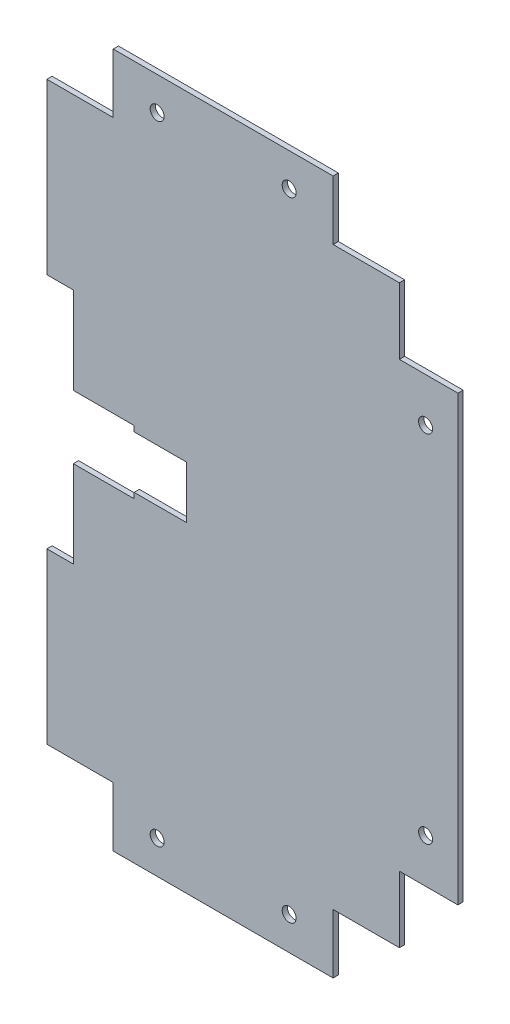
from build123d import *

# Parameters (mm, degrees)
SKETCH1_R           = 4
BOSS_EXTRUDE2_DEPTH = 3


with BuildPart() as part:
    # Sketch1 → Boss-Extrude2 (new body)
    with BuildSketch(Plane.XY):
        Polygon((160.82, 34.005), (195.645, 34.005), (198.82, 34.005), (198.82, 37.18), (198.82, 72.005), (232.325, 72.005), (232.325, 325.985), (198.82, 325.985), (198.82, 360.81), (198.82, 363.985), (195.645, 363.985), (160.82, 363.985), (160.82, 397.99), (34.825, 397.99), (34.825, 363.985), (0, 363.985), (-3.175, 363.985), (-3.175, 266.995), (12.005, 266.995), (12.005, 252), (12.005, 217.17), (46.835, 217.17), (46.835, 213.995), (76.83, 213.995), (76.83, 183.995), (46.835, 183.995), (46.835, 180.82), (12.005, 180.82), (12.005, 145.99), (12.005, 130.995), (-3.175, 130.995), (-3.175, 34.005), (0, 34.005), (34.825, 34.005), (34.825, 0), (160.82, 0), align=None)
        with Locations((60, 19.005)):
            Circle(SKETCH1_R, mode=Mode.SUBTRACT)
        with Locations((135.645, 19.005)):
            Circle(SKETCH1_R, mode=Mode.SUBTRACT)
        with Locations((213.82, 97.18)):
            Circle(SKETCH1_R, mode=Mode.SUBTRACT)
        with Locations((60, 378.985)):
            Circle(SKETCH1_R, mode=Mode.SUBTRACT)
        with Locations((135.645, 378.985)):
            Circle(SKETCH1_R, mode=Mode.SUBTRACT)
        with Locations((213.82, 300.81)):
            Circle(SKETCH1_R, mode=Mode.SUBTRACT)
    extrude(amount=BOSS_EXTRUDE2_DEPTH)


solid = part.part
